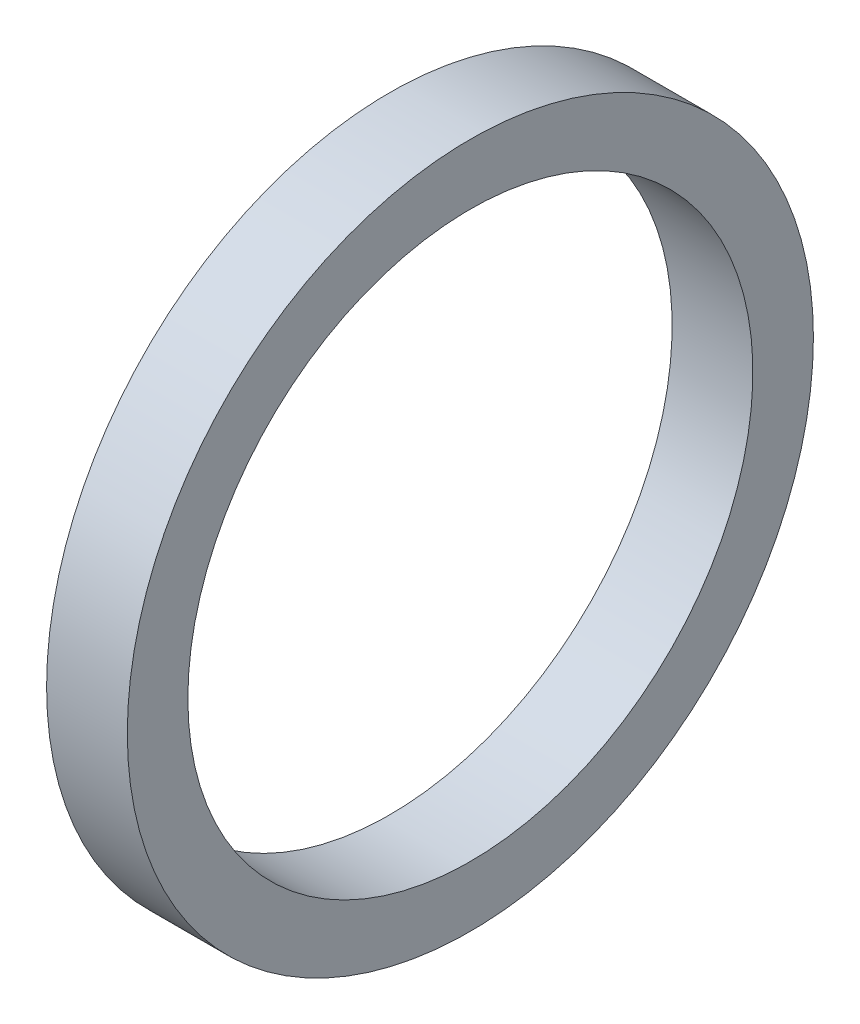
from build123d import *

# Parameters (mm, degrees)
SKETCH_1_W = 10
SKETCH_1_H = 7.5


with BuildPart() as part:
    # 草图1 → 旋转1 (revolve)
    with BuildSketch(Plane.XY, mode=Mode.PRIVATE) as revolve_1_sk:
        with Locations((5, 38.75)):
            Rectangle(SKETCH_1_W, SKETCH_1_H)
    revolve(revolve_1_sk.sketch.rotate(Axis((-59.659258107, 0, 0), (1, 0, 0)), 90), axis=Axis((-59.659258107, 0, 0), (1, 0, 0)))


solid = part.part
